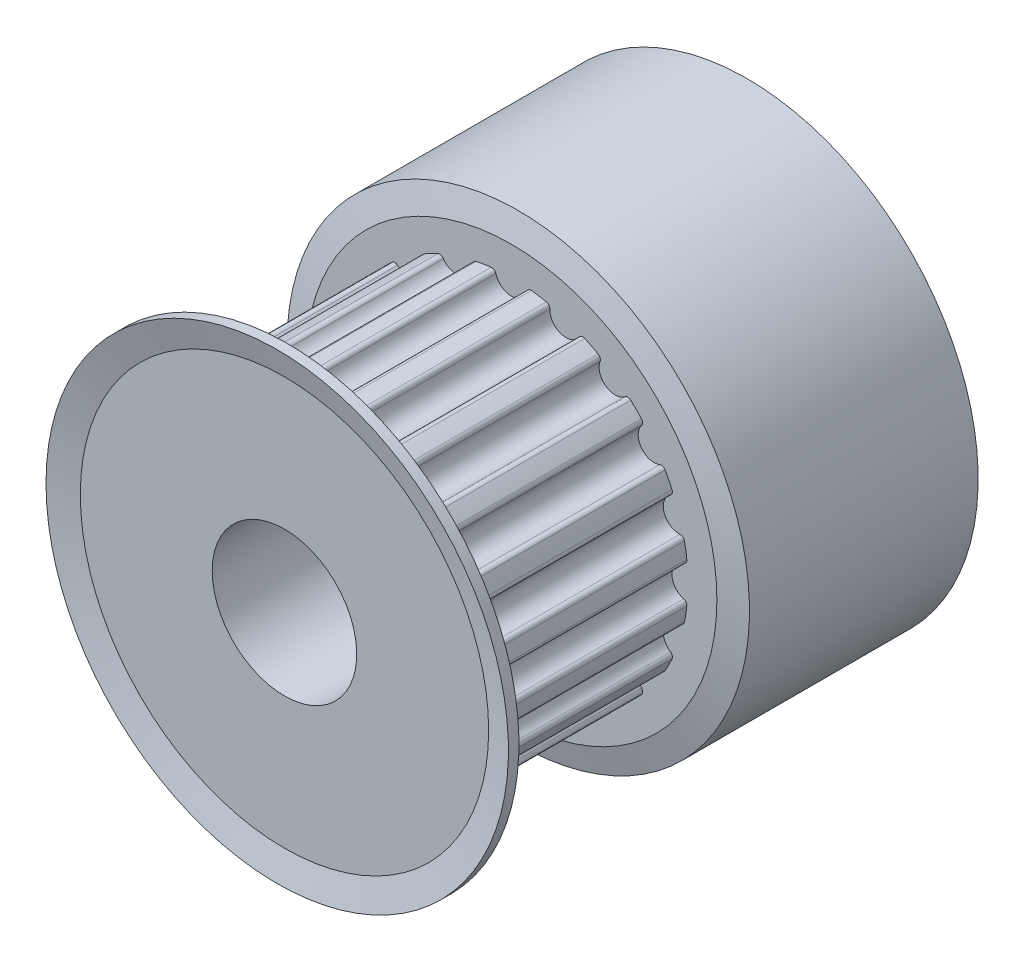
from build123d import *

# Parameters (mm, degrees)
SKETCH2_R          = 0.555
CUT_EXTRUDE1_DEPTH = 7.5
FILLET1_R          = 0.15


with BuildPart() as part:
    # Sketch1 → Revolve1 (revolve)
    with BuildSketch(Plane(origin=(0, 0, 0), x_dir=(0, 0, -1), z_dir=(1, 0, 0)), mode=Mode.PRIVATE) as revolve1_sk:
        Polygon((-16, -2.5), (0, -2.5), (0, -8), (-7.911525219, -8), (-8.15, -7.11), (-8.15, -6.11), (-15.65, -6.11), (-15.65, -7.11), (-15.888474781, -8), (-16.250821444, -8), (-16, -7.063921626), (-16, -6.11), align=None)
    revolve(revolve1_sk.sketch.rotate(Axis((0, 0, 0), (0, 0, 1)), 270), axis=Axis((0, 0, 0), (0, 0, 1)))

    # Sketch2 → Cut-Extrude1 (cut)
    with BuildSketch(Plane.XY.offset(8.15)):
        with Locations((0, 6.11)):
            Circle(SKETCH2_R)
        with Locations((1.888093836, 5.810955315)):
            Circle(SKETCH2_R)
        with Locations((3.591367892, 4.943093836)):
            Circle(SKETCH2_R)
        with Locations((4.943093836, 3.591367892)):
            Circle(SKETCH2_R)
        with Locations((5.810955315, 1.888093836)):
            Circle(SKETCH2_R)
        with Locations((6.11, 0)):
            Circle(SKETCH2_R)
        with Locations((5.810955315, -1.888093836)):
            Circle(SKETCH2_R)
        with Locations((4.943093836, -3.591367892)):
            Circle(SKETCH2_R)
        with Locations((3.591367892, -4.943093836)):
            Circle(SKETCH2_R)
        with Locations((1.888093836, -5.810955315)):
            Circle(SKETCH2_R)
        with Locations((0, -6.11)):
            Circle(SKETCH2_R)
        with Locations((-1.888093836, -5.810955315)):
            Circle(SKETCH2_R)
        with Locations((-3.591367892, -4.943093836)):
            Circle(SKETCH2_R)
        with Locations((-4.943093836, -3.591367892)):
            Circle(SKETCH2_R)
        with Locations((-5.810955315, -1.888093836)):
            Circle(SKETCH2_R)
        with Locations((-6.11, 0)):
            Circle(SKETCH2_R)
        with Locations((-5.810955315, 1.888093836)):
            Circle(SKETCH2_R)
        with Locations((-4.943093836, 3.591367892)):
            Circle(SKETCH2_R)
        with Locations((-3.591367892, 4.943093836)):
            Circle(SKETCH2_R)
        with Locations((-1.888093836, 5.810955315)):
            Circle(SKETCH2_R)
    extrude(amount=CUT_EXTRUDE1_DEPTH, mode=Mode.SUBTRACT)

    # Fillet1
    fillet1_edges = [part.edges().sort_by_distance(p)[0] for p in [
        (3.128010703, -5.248585433, 11.9),
        (4.025092911, -4.596817057, 11.9),
        (1.353012867, -5.958309843, 11.9),
        (2.407596251, -5.61565493, 11.9),
        (-0.554427295, -6.084793372, 11.9),
        (0.554427295, -6.084793372, 11.9),
        (-2.407596251, -5.61565493, 11.9),
        (-1.353012867, -5.958309843, 11.9),
        (-4.025092911, -4.596817057, 11.9),
        (-3.128010703, -5.248585433, 11.9),
        (-5.248585433, -3.128010703, 11.9),
        (-4.596817057, -4.025092911, 11.9),
        (-5.958309843, -1.353012867, 11.9),
        (-5.61565493, -2.407596251, 11.9),
        (-6.084793372, 0.554427295, 11.9),
        (-6.084793372, -0.554427295, 11.9),
        (-5.61565493, 2.407596251, 11.9),
        (-5.958309843, 1.353012867, 11.9),
        (-4.596817057, 4.025092911, 11.9),
        (-5.248585433, 3.128010703, 11.9),
        (-3.128010703, 5.248585433, 11.9),
        (-4.025092911, 4.596817057, 11.9),
        (-1.353012867, 5.958309843, 11.9),
        (-2.407596251, 5.61565493, 11.9),
        (0.554427295, 6.084793372, 11.9),
        (-0.554427295, 6.084793372, 11.9),
        (2.407596251, 5.61565493, 11.9),
        (1.353012867, 5.958309843, 11.9),
        (4.025092911, 4.596817057, 11.9),
        (3.128010703, 5.248585433, 11.9),
        (5.248585433, 3.128010703, 11.9),
        (4.596817057, 4.025092911, 11.9),
        (5.958309843, 1.353012867, 11.9),
        (5.61565493, 2.407596251, 11.9),
        (6.084793372, -0.554427295, 11.9),
        (6.084793372, 0.554427295, 11.9),
        (5.61565493, -2.407596251, 11.9),
        (5.958309843, -1.353012867, 11.9),
        (4.596817057, -4.025092911, 11.9),
        (5.248585433, -3.128010703, 11.9),
    ]]
    fillet(fillet1_edges, radius=FILLET1_R)


solid = part.part
